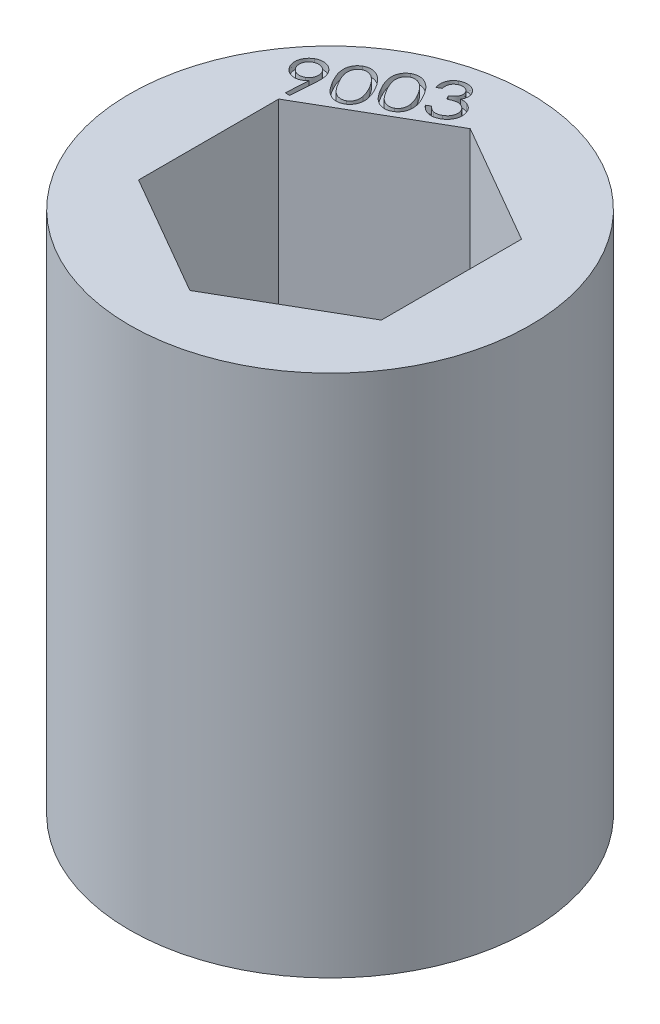
from build123d import *

# Parameters (mm, degrees)
SKETCH1_R           = 11.1125
BOSS_EXTRUDE1_DEPTH = 29.0449
CUT_EXTRUDE1_DEPTH  = 0.4


with BuildPart() as part:
    # Sketch1 → Boss-Extrude1 (new body)
    with BuildSketch(Plane(origin=(0, 0, 0), x_dir=(1, 0, 0), z_dir=(0, 1, 0))):
        with Locations(Location((0, 0, 0), (0, 0, 270))):
            Circle(SKETCH1_R)
        Polygon((6.731, -3.886144662), (6.731, 3.886144662), (0, 7.772289324), (-6.731, 3.886144662), (-6.731, -3.886144662), (0, -7.772289324), align=None, mode=Mode.SUBTRACT)
    extrude(amount=BOSS_EXTRUDE1_DEPTH)

    # Sketch2 → Cut-Extrude1 (cut)
    # profile 1 of 4: a face of its own
    with BuildSketch(Plane(origin=(0, 29.0449, 0), x_dir=(1, 0, 0), z_dir=(0, 1, 0))):
        with BuildLine():
            Line((-6.598355461, 4.357896038), (-6.846147929, 4.370107577))
            Line((-6.846147929, 4.370107577), (-6.772878698, 5.613140429))
            add(Edge.make_bspline(
                [(-6.772878698, 5.613140429), (-6.788864714, 5.595711477), (-6.819961058, 5.561808304), (-6.870461775, 5.517091536), (-6.921032154, 5.477274681), (-6.956844141, 5.455418497), (-6.974369082, 5.444722961)],
                knots=[0, 0, 0, 0, 1.07557127, 2.092224476, 3.066411598, 4, 4, 4, 4], degree=3))
            add(Edge.make_bspline(
                [(-6.974369082, 5.444722961), (-6.996027616, 5.432904379), (-7.038879978, 5.409520792), (-7.106176492, 5.382805548), (-7.1743062, 5.363019261), (-7.243485923, 5.351634769), (-7.313327188, 5.34617577), (-7.384307962, 5.348904522), (-7.456015187, 5.359263899), (-7.52786841, 5.376537909), (-7.598132561, 5.400154482), (-7.665130923, 5.430284828), (-7.728072742, 5.466545614), (-7.786704707, 5.509042728), (-7.84153947, 5.557109349), (-7.89205935, 5.611245018), (-7.938164198, 5.671760524), (-7.965060712, 5.71550577), (-7.978768121, 5.737799884)],
                knots=[0, 0, 0, 0, 1.015135184, 2.008489705, 2.974464217, 3.930823522, 4.890110555, 5.854468119, 6.84900024, 7.868689235, 8.893387844, 9.896732215, 10.888539014, 11.878968029, 12.873598221, 13.886496971, 14.922884625, 16, 16, 16, 16], degree=3))
            add(Edge.make_bspline(
                [(-7.978768121, 5.737799884), (-7.995611595, 5.769279769), (-8.028750743, 5.831215719), (-8.062305572, 5.929820561), (-8.084162813, 6.029511748), (-8.090172936, 6.130611364), (-8.084137157, 6.231502917), (-8.062669024, 6.330535767), (-8.028206879, 6.427199519), (-7.980529557, 6.520164838), (-7.921196046, 6.607161568), (-7.852461509, 6.686255603), (-7.773156137, 6.754991782), (-7.714032388, 6.792128443), (-7.684164756, 6.810888827)],
                knots=[0, 0, 0, 0, 1.035324533, 2.036977218, 3.013660684, 3.991039457, 4.968418229, 5.940283026, 6.923354643, 7.941094773, 8.965736768, 9.974485588, 10.976767849, 12, 12, 12, 12], degree=3))
            add(Edge.make_bspline(
                [(-7.684164756, 6.810888827), (-7.653693123, 6.827192744), (-7.593433111, 6.859435004), (-7.4967602, 6.892254026), (-7.397402332, 6.912378093), (-7.296149159, 6.919369798), (-7.194788036, 6.913586556), (-7.095880553, 6.893418492), (-6.999961911, 6.86016036), (-6.909304283, 6.812588572), (-6.824386747, 6.754924979), (-6.748026257, 6.68747898), (-6.681468398, 6.610520658), (-6.645475527, 6.553253132), (-6.627357865, 6.524426487)],
                knots=[0, 0, 0, 0, 1.019400264, 2.015942902, 3.002372847, 4.006779929, 5.005536382, 5.991966327, 6.979044859, 7.994053264, 9.007032045, 10.004279611, 10.995418019, 12, 12, 12, 12], degree=3))
            add(Edge.make_bspline(
                [(-6.627357865, 6.524426487), (-6.614862873, 6.501068901), (-6.589434869, 6.45353491), (-6.559163833, 6.37672861), (-6.534915546, 6.294426336), (-6.519193441, 6.221904552), (-6.509936287, 6.160237223), (-6.504111937, 6.110024927), (-6.501071936, 6.056340366), (-6.498121146, 5.999194236), (-6.497929673, 5.938775024), (-6.498936684, 5.874822916), (-6.501451823, 5.807470523), (-6.504296769, 5.761369683), (-6.505751294, 5.737799884)],
                knots=[0, 0, 0, 0, 1.179517641, 2.400384276, 3.669978525, 4.99951221, 5.702757638, 6.447991837, 7.250775919, 8.098000084, 8.997311831, 9.942054579, 10.947842213, 12, 12, 12, 12], degree=3))
            Line((-6.505751294, 5.737799884), (-6.598355461, 4.357896038))
        make_face()
        with BuildLine():
            add(Edge.make_bspline(
                [(-7.034917961, 5.66656591), (-7.019269493, 5.676088627), (-6.988537053, 5.694790541), (-6.946707271, 5.727867056), (-6.908591753, 5.763381258), (-6.875542002, 5.802952601), (-6.846336799, 5.845338903), (-6.8213924, 5.890890013), (-6.800208249, 5.939485892), (-6.784487326, 5.990958285), (-6.772439824, 6.043461533), (-6.766678935, 6.096191308), (-6.764740866, 6.148129668), (-6.76886222, 6.199521812), (-6.778826156, 6.249855233), (-6.792974762, 6.299751596), (-6.812959799, 6.348796291), (-6.829909236, 6.380239364), (-6.838515717, 6.396205333)],
                knots=[0, 0, 0, 0, 1.045108442, 2.052516081, 3.039037663, 4.014948609, 4.990090363, 5.974041511, 6.976128051, 8.011453109, 9.043011603, 10.047295345, 11.035574291, 12.007150616, 12.98344593, 13.961229243, 14.964765542, 16, 16, 16, 16], degree=3))
            add(Edge.make_bspline(
                [(-6.838515717, 6.396205333), (-6.847871356, 6.411679568), (-6.86636199, 6.442263091), (-6.89914416, 6.483897706), (-6.935003914, 6.521507302), (-6.974365916, 6.554596992), (-7.016803772, 6.583720642), (-7.062203872, 6.60884321), (-7.111061882, 6.62922912), (-7.162373534, 6.645218392), (-7.214952681, 6.656911905), (-7.267576663, 6.663781619), (-7.319597528, 6.66468438), (-7.370883969, 6.660584098), (-7.421612083, 6.651535287), (-7.471568591, 6.636387785), (-7.521278238, 6.61688834), (-7.552729794, 6.599421478), (-7.568663954, 6.59057232)],
                knots=[0, 0, 0, 0, 1.031712043, 2.039092063, 3.018573684, 3.994457873, 4.969572892, 5.953497063, 6.951758218, 7.98705489, 9.018585102, 10.024008046, 11.012022604, 11.983572292, 12.958061913, 13.947831088, 14.960318852, 16, 16, 16, 16], degree=3))
            add(Edge.make_bspline(
                [(-7.568663954, 6.59057232), (-7.584170502, 6.581255909), (-7.61470341, 6.562911586), (-7.655879463, 6.529593085), (-7.694002078, 6.494296313), (-7.726978587, 6.454666761), (-7.756327049, 6.412455587), (-7.780550555, 6.366603147), (-7.801887935, 6.318183416), (-7.817557037, 6.266682733), (-7.82961885, 6.214187069), (-7.83535615, 6.161624158), (-7.837312362, 6.109857024), (-7.833190206, 6.058633972), (-7.823230135, 6.008300645), (-7.809080486, 5.958404257), (-7.789095732, 5.909359568), (-7.772146256, 5.877916495), (-7.763539756, 5.861950525)],
                knots=[0, 0, 0, 0, 1.034021631, 2.036022986, 3.024725885, 4.002794686, 4.980092595, 5.961574923, 6.965877195, 8.00349148, 9.037330872, 10.043835206, 11.024597356, 11.998321951, 12.97677597, 13.956721278, 14.962476515, 16, 16, 16, 16], degree=3))
            add(Edge.make_bspline(
                [(-7.763539756, 5.861950525), (-7.754184522, 5.846475673), (-7.735694691, 5.81589093), (-7.702906669, 5.774265215), (-7.667068422, 5.736622907), (-7.627734056, 5.703743934), (-7.585718977, 5.674233861), (-7.540217555, 5.649466258), (-7.491641806, 5.628251814), (-7.440163817, 5.612539313), (-7.38766207, 5.60048955), (-7.334931905, 5.594729249), (-7.282993647, 5.592791027), (-7.231601476, 5.596912421), (-7.181268062, 5.606876346), (-7.131371697, 5.621024955), (-7.082327002, 5.641009992), (-7.05088393, 5.657959429), (-7.034917961, 5.66656591)],
                knots=[0, 0, 0, 0, 1.033571637, 2.042767394, 3.024014467, 4.001657624, 4.970548117, 5.956245748, 6.96011096, 7.997273687, 9.030663166, 10.03672948, 11.026762591, 12.000063433, 12.97809164, 13.957610489, 14.962928033, 16, 16, 16, 16], degree=3))
        make_face(mode=Mode.SUBTRACT)
    # profile 2 of 4: a face of its own
    with BuildSketch(Plane(origin=(0, 29.0449, 0), x_dir=(1, 0, 0), z_dir=(0, 1, 0))):
        with BuildLine():
            add(Edge.make_bspline(
                [(-6.062809511, 6.205908859), (-6.082915658, 6.241213231), (-6.122019175, 6.309875075), (-6.174656197, 6.412282578), (-6.221774323, 6.509813869), (-6.262072141, 6.602981302), (-6.295917571, 6.691537875), (-6.322887041, 6.775666651), (-6.344260428, 6.855197202), (-6.358510659, 6.930930861), (-6.367241982, 7.003365304), (-6.371223871, 7.073038031), (-6.371478384, 7.14050867), (-6.366893402, 7.205811525), (-6.357828111, 7.268933517), (-6.344055002, 7.329853086), (-6.325598272, 7.388464523), (-6.303242535, 7.444957262), (-6.277074823, 7.498956073), (-6.245971467, 7.549318144), (-6.21280028, 7.597425621), (-6.175243181, 7.641625167), (-6.134995217, 7.683385044), (-6.090531578, 7.721208048), (-6.043175963, 7.756801283), (-6.009230412, 7.777404912), (-5.992084351, 7.787811904)],
                knots=[0, 0, 0, 0, 1.642217524, 3.193873097, 4.653599743, 6.020219012, 7.296149585, 8.484364078, 9.590266645, 10.622995624, 11.596731579, 12.537641419, 13.442669779, 14.322439731, 15.181528583, 16.018162769, 16.844365298, 17.663022962, 18.472528165, 19.266229043, 20.053716379, 20.832379209, 21.608138827, 22.395685855, 23.18965321, 24, 24, 24, 24], degree=3))
            add(Edge.make_bspline(
                [(-5.992084351, 7.787811904), (-5.974256713, 7.797613629), (-5.938913661, 7.817045418), (-5.883569808, 7.840677277), (-5.827828183, 7.860841538), (-5.770743017, 7.875622824), (-5.712884751, 7.88574646), (-5.653853901, 7.891399375), (-5.593970317, 7.892375784), (-5.533266337, 7.888714413), (-5.471934607, 7.880772777), (-5.410521328, 7.866935525), (-5.349299474, 7.847750081), (-5.287727945, 7.824621227), (-5.22704648, 7.794722829), (-5.166095387, 7.760368326), (-5.104965892, 7.721377255), (-5.044390875, 7.676169596), (-4.983125826, 7.625542358), (-4.922505127, 7.567525488), (-4.861616669, 7.502539905), (-4.801373878, 7.430341593), (-4.741318852, 7.350960318), (-4.680544759, 7.265093467), (-4.620831969, 7.171385014), (-4.582139772, 7.105945627), (-4.562316723, 7.072419275)],
                knots=[0, 0, 0, 0, 0.815881076, 1.617473213, 2.411751612, 3.192532544, 3.980223438, 4.766442947, 5.569622482, 6.380892254, 7.204795063, 8.048528362, 8.903143009, 9.777765604, 10.684831081, 11.614241792, 12.584586996, 13.591843045, 14.645331516, 15.771781295, 16.956234458, 18.217113798, 19.542884518, 20.949560407, 22.437178076, 24, 24, 24, 24], degree=3))
            add(Edge.make_bspline(
                [(-4.562316723, 7.072419275), (-4.543312875, 7.038597047), (-4.506249772, 6.972633735), (-4.455016991, 6.874526574), (-4.411010566, 6.77942361), (-4.372379623, 6.688105499), (-4.34043532, 6.600262208), (-4.314088229, 6.51595685), (-4.294178627, 6.435078985), (-4.280175723, 6.357397142), (-4.272385411, 6.282552936), (-4.267753497, 6.210544887), (-4.2691827, 6.140865887), (-4.273761909, 6.073470233), (-4.284273749, 6.008422226), (-4.298289042, 5.945579715), (-4.317156733, 5.885315328), (-4.340723943, 5.827749719), (-4.36796593, 5.772885384), (-4.39945707, 5.721345977), (-4.433267076, 5.672341106), (-4.471035107, 5.626672817), (-4.513229687, 5.585156545), (-4.557769799, 5.545849061), (-4.605976313, 5.509724128), (-4.640485635, 5.48887189), (-4.657973774, 5.478304692)],
                knots=[0, 0, 0, 0, 1.558572261, 3.039675171, 4.44500239, 5.767404933, 7.021920233, 8.19867626, 9.314183841, 10.366093107, 11.366862767, 12.335955634, 13.262731656, 14.164729598, 15.047477431, 15.907015182, 16.749641984, 17.580952634, 18.403702246, 19.207672054, 20.005351578, 20.794016824, 21.584181799, 22.380929523, 23.179510693, 24, 24, 24, 24], degree=3))
            add(Edge.make_bspline(
                [(-4.657973774, 5.478304692), (-4.675490038, 5.468740296), (-4.710270171, 5.449749318), (-4.764206789, 5.425635226), (-4.819542798, 5.407055827), (-4.875347505, 5.391905469), (-4.93230514, 5.382546733), (-4.989921221, 5.37670867), (-5.048618828, 5.375852517), (-5.108036205, 5.379192271), (-5.167677293, 5.388186067), (-5.227421614, 5.401024475), (-5.28654438, 5.420419966), (-5.345831974, 5.443717316), (-5.404926689, 5.472446443), (-5.463983037, 5.505980951), (-5.522577588, 5.545026051), (-5.581614741, 5.58883912), (-5.640268105, 5.63968601), (-5.69958948, 5.697585031), (-5.759441302, 5.763112365), (-5.819377976, 5.836749383), (-5.880097416, 5.917809298), (-5.940703878, 6.006905526), (-6.002700965, 6.103211029), (-6.042369443, 6.170986193), (-6.062809511, 6.205908859)],
                knots=[0, 0, 0, 0, 0.807491903, 1.603348545, 2.386916451, 3.167713854, 3.940658363, 4.719915701, 5.50935356, 6.313835313, 7.125313705, 7.947948844, 8.783651521, 9.640150085, 10.524255013, 11.440287308, 12.386399569, 13.372019105, 14.413529699, 15.525036669, 16.724996316, 18.002813491, 19.365932914, 20.822335035, 22.362637201, 24, 24, 24, 24], degree=3))
        make_face()
        with BuildLine():
            add(Edge.make_bspline(
                [(-5.852669287, 6.32140966), (-5.835208653, 6.291452258), (-5.801397235, 6.233441638), (-5.749344905, 6.15088375), (-5.698461984, 6.07514583), (-5.649351496, 6.005760887), (-5.601093746, 5.943508849), (-5.55364127, 5.888541706), (-5.507939043, 5.839824001), (-5.462846979, 5.797720872), (-5.418018196, 5.761175024), (-5.373209535, 5.728960986), (-5.3279313, 5.70101178), (-5.282589064, 5.676928917), (-5.23681649, 5.656938325), (-5.19085526, 5.64045682), (-5.144233865, 5.628976309), (-5.083175813, 5.618040821), (-5.008197851, 5.613853809), (-4.921559855, 5.622509197), (-4.839570384, 5.643895531), (-4.790056323, 5.669197069), (-4.76533355, 5.681830333)],
                knots=[0, 0, 0, 0, 1.475228016, 2.856686104, 4.15161897, 5.357081144, 6.47289893, 7.501387829, 8.445726694, 9.313720896, 10.124066195, 10.905058304, 11.660046733, 12.386348828, 13.08755313, 13.783651734, 14.460982071, 15.127735434, 16.421461315, 17.639985157, 18.821625413, 20, 20, 20, 20], degree=3))
            add(Edge.make_bspline(
                [(-4.76533355, 5.681830333), (-4.741832268, 5.696984554), (-4.695095654, 5.727121505), (-4.635260688, 5.786851944), (-4.585254589, 5.856751843), (-4.551822138, 5.922530467), (-4.531196504, 5.979639176), (-4.518164402, 6.024928674), (-4.509810591, 6.072515738), (-4.504496544, 6.121823726), (-4.503942481, 6.173023731), (-4.505677671, 6.226066029), (-4.5119235, 6.2809619), (-4.518681231, 6.317883674), (-4.522120409, 6.336674083)],
                knots=[0, 0, 0, 0, 1.342886321, 2.670576022, 4.038999414, 5.466462105, 6.205051725, 6.959707281, 7.731476591, 8.527516338, 9.344012544, 10.193626534, 11.080691652, 12, 12, 12, 12], degree=3))
            add(Edge.make_bspline(
                [(-4.522120409, 6.336674083), (-4.526923687, 6.360485524), (-4.536699476, 6.408947354), (-4.557023801, 6.48165033), (-4.580913205, 6.556239717), (-4.609297259, 6.632127806), (-4.642293402, 6.709349431), (-4.678795675, 6.788244225), (-4.720014948, 6.868719848), (-4.750373811, 6.922091932), (-4.765842364, 6.949286262)],
                knots=[0, 0, 0, 0, 0.879876913, 1.790754508, 2.73331625, 3.717259664, 4.725112015, 5.77538776, 6.866507818, 8, 8, 8, 8], degree=3))
            add(Edge.make_bspline(
                [(-4.765842364, 6.949286262), (-4.781575844, 6.976212113), (-4.812359769, 7.02889489), (-4.86095363, 7.103874502), (-4.908595154, 7.174498877), (-4.956915948, 7.23974614), (-5.005817917, 7.299541747), (-5.054067683, 7.354972678), (-5.10294632, 7.404787783), (-5.151903766, 7.449753667), (-5.200746818, 7.48987811), (-5.248914016, 7.525749658), (-5.297203452, 7.556382889), (-5.344938521, 7.583112372), (-5.392665232, 7.60484073), (-5.439849373, 7.622508021), (-5.486852819, 7.635354401), (-5.548109252, 7.645797129), (-5.622641395, 7.65009549), (-5.708706197, 7.642246841), (-5.789903048, 7.620660396), (-5.838957607, 7.595688265), (-5.863354383, 7.583268634)],
                knots=[0, 0, 0, 0, 1.327522451, 2.597413504, 3.803087542, 4.954092809, 6.052504639, 7.091116491, 8.08170511, 9.022070092, 9.919800897, 10.771882377, 11.577119672, 12.352806521, 13.099205072, 13.807429758, 14.495830891, 15.170113202, 16.450227669, 17.661618134, 18.837030004, 20, 20, 20, 20], degree=3))
            add(Edge.make_bspline(
                [(-5.863354383, 7.583268634), (-5.886890302, 7.568145944), (-5.933796306, 7.538007117), (-5.993340773, 7.477518649), (-6.044374308, 7.407224434), (-6.077385517, 7.340179617), (-6.099346568, 7.282609341), (-6.111133271, 7.236593582), (-6.120517391, 7.189072402), (-6.126227153, 7.139557728), (-6.127278826, 7.088193991), (-6.126177517, 7.035133924), (-6.11999488, 6.980501786), (-6.111648193, 6.923473373), (-6.098120247, 6.863264749), (-6.079098581, 6.79908088), (-6.054375083, 6.730470297), (-6.024874815, 6.657059747), (-5.989628856, 6.579451556), (-5.949143771, 6.497212578), (-5.90360949, 6.410354322), (-5.869994702, 6.351660878), (-5.852669287, 6.32140966)],
                knots=[0, 0, 0, 0, 1.186584607, 2.364808541, 3.584028067, 4.867913378, 5.52979883, 6.201670858, 6.884946004, 7.589109066, 8.317961587, 9.068444384, 9.84432244, 10.65432116, 11.518850237, 12.466086659, 13.499587148, 14.619373863, 15.830028341, 17.123623296, 18.517485242, 20, 20, 20, 20], degree=3))
        make_face(mode=Mode.SUBTRACT)
    # profile 3 of 4: a face of its own
    with BuildSketch(Plane(origin=(0, 29.0449, 0), x_dir=(1, 0, 0), z_dir=(0, 1, 0))):
        with BuildLine():
            add(Edge.make_bspline(
                [(-4.370729107, 7.182831936), (-4.390835254, 7.218136308), (-4.429938771, 7.286798152), (-4.482575792, 7.389205655), (-4.529693919, 7.486736946), (-4.569991737, 7.579904379), (-4.603837167, 7.668460952), (-4.630806637, 7.752589727), (-4.652180024, 7.832120278), (-4.666430254, 7.907853938), (-4.675161578, 7.980288381), (-4.679143467, 8.049961108), (-4.67939798, 8.117431747), (-4.674812998, 8.182734602), (-4.665747707, 8.245856594), (-4.651974598, 8.306776163), (-4.633517868, 8.3653876), (-4.611162131, 8.421880339), (-4.584994419, 8.47587915), (-4.553891063, 8.526241221), (-4.520719875, 8.574348698), (-4.483162777, 8.618548244), (-4.442914813, 8.660308121), (-4.398451173, 8.698131125), (-4.351095559, 8.73372436), (-4.317150008, 8.754327988), (-4.300003947, 8.76473498)],
                knots=[0, 0, 0, 0, 1.642217524, 3.193873097, 4.653599743, 6.020219012, 7.296149585, 8.484364078, 9.590266645, 10.622995624, 11.596731579, 12.537641419, 13.442669779, 14.322439731, 15.181528583, 16.018162769, 16.844365298, 17.663022962, 18.472528165, 19.266229043, 20.053716379, 20.832379209, 21.608138827, 22.395685855, 23.18965321, 24, 24, 24, 24], degree=3))
            add(Edge.make_bspline(
                [(-4.300003947, 8.76473498), (-4.282176309, 8.774536706), (-4.246833256, 8.793968495), (-4.191489404, 8.817600354), (-4.135747778, 8.837764615), (-4.078662613, 8.852545901), (-4.020804346, 8.862669537), (-3.961773496, 8.868322452), (-3.901889913, 8.869298861), (-3.841185933, 8.86563749), (-3.779854202, 8.857695854), (-3.718440924, 8.843858602), (-3.65721907, 8.824673158), (-3.59564754, 8.801544304), (-3.534966076, 8.771645906), (-3.474014982, 8.737291403), (-3.412885487, 8.698300332), (-3.352310471, 8.653092673), (-3.291045421, 8.602465435), (-3.230424723, 8.544448564), (-3.169536265, 8.479462982), (-3.109293474, 8.40726467), (-3.049238447, 8.327883395), (-2.988464355, 8.242016544), (-2.928751564, 8.148308091), (-2.890059368, 8.082868704), (-2.870236319, 8.049342352)],
                knots=[0, 0, 0, 0, 0.815881076, 1.617473213, 2.411751612, 3.192532544, 3.980223438, 4.766442947, 5.569622482, 6.380892254, 7.204795063, 8.048528362, 8.903143009, 9.777765604, 10.684831081, 11.614241792, 12.584586996, 13.591843045, 14.645331516, 15.771781295, 16.956234458, 18.217113798, 19.542884518, 20.949560407, 22.437178076, 24, 24, 24, 24], degree=3))
            add(Edge.make_bspline(
                [(-2.870236319, 8.049342352), (-2.851232471, 8.015520124), (-2.814169368, 7.949556812), (-2.762936586, 7.851449651), (-2.718930161, 7.756346687), (-2.680299219, 7.665028576), (-2.648354915, 7.577185285), (-2.622007825, 7.492879927), (-2.602098223, 7.412002062), (-2.588095319, 7.334320219), (-2.580305007, 7.259476013), (-2.575673093, 7.187467964), (-2.577102296, 7.117788964), (-2.581681505, 7.05039331), (-2.592193345, 6.985345303), (-2.606208637, 6.922502792), (-2.625076329, 6.862238405), (-2.648643538, 6.804672796), (-2.675885526, 6.749808461), (-2.707376666, 6.698269054), (-2.741186672, 6.649264183), (-2.778954702, 6.603595894), (-2.821149282, 6.562079621), (-2.865689395, 6.522772138), (-2.913895909, 6.486647205), (-2.948405231, 6.465794967), (-2.96589337, 6.455227769)],
                knots=[0, 0, 0, 0, 1.558572261, 3.039675171, 4.44500239, 5.767404933, 7.021920233, 8.19867626, 9.314183841, 10.366093107, 11.366862767, 12.335955634, 13.262731656, 14.164729598, 15.047477431, 15.907015182, 16.749641984, 17.580952634, 18.403702246, 19.207672054, 20.005351578, 20.794016824, 21.584181799, 22.380929523, 23.179510693, 24, 24, 24, 24], degree=3))
            add(Edge.make_bspline(
                [(-2.96589337, 6.455227769), (-2.983409634, 6.445663373), (-3.018189767, 6.426672395), (-3.072126385, 6.402558303), (-3.127462394, 6.383978904), (-3.183267101, 6.368828546), (-3.240224736, 6.35946981), (-3.297840817, 6.353631747), (-3.356538424, 6.352775594), (-3.415955801, 6.356115348), (-3.475596889, 6.365109144), (-3.53534121, 6.377947552), (-3.594463976, 6.397343043), (-3.65375157, 6.420640393), (-3.712846285, 6.44936952), (-3.771902633, 6.482904028), (-3.830497184, 6.521949128), (-3.889534337, 6.565762197), (-3.9481877, 6.616609087), (-4.007509076, 6.674508108), (-4.067360898, 6.740035441), (-4.127297572, 6.81367246), (-4.188017012, 6.894732375), (-4.248623474, 6.983828603), (-4.310620561, 7.080134106), (-4.350289039, 7.14790927), (-4.370729107, 7.182831936)],
                knots=[0, 0, 0, 0, 0.807491903, 1.603348545, 2.386916451, 3.167713854, 3.940658363, 4.719915701, 5.50935356, 6.313835313, 7.125313705, 7.947948844, 8.783651521, 9.640150085, 10.524255013, 11.440287308, 12.386399569, 13.372019105, 14.413529699, 15.525036669, 16.724996316, 18.002813491, 19.365932914, 20.822335035, 22.362637201, 24, 24, 24, 24], degree=3))
        make_face()
        with BuildLine():
            add(Edge.make_bspline(
                [(-4.160588883, 7.298332737), (-4.143128249, 7.268375335), (-4.109316831, 7.210364715), (-4.0572645, 7.127806827), (-4.00638158, 7.052068907), (-3.957271092, 6.982683964), (-3.909013342, 6.920431926), (-3.861560866, 6.865464783), (-3.815858638, 6.816747078), (-3.770766574, 6.774643949), (-3.725937791, 6.738098101), (-3.681129131, 6.705884063), (-3.635850896, 6.677934857), (-3.59050866, 6.653851994), (-3.544736086, 6.633861402), (-3.498774856, 6.617379897), (-3.45215346, 6.605899385), (-3.391095409, 6.594963898), (-3.316117447, 6.590776885), (-3.229479451, 6.599432274), (-3.14748998, 6.620818608), (-3.097975919, 6.646120146), (-3.073253146, 6.65875341)],
                knots=[0, 0, 0, 0, 1.475228016, 2.856686104, 4.15161897, 5.357081144, 6.47289893, 7.501387829, 8.445726694, 9.313720896, 10.124066195, 10.905058304, 11.660046733, 12.386348828, 13.08755313, 13.783651734, 14.460982071, 15.127735434, 16.421461315, 17.639985157, 18.821625413, 20, 20, 20, 20], degree=3))
            add(Edge.make_bspline(
                [(-3.073253146, 6.65875341), (-3.049751864, 6.673907631), (-3.00301525, 6.704044582), (-2.943180284, 6.763775021), (-2.893174185, 6.83367492), (-2.859741734, 6.899453544), (-2.839116099, 6.956562253), (-2.826083998, 7.001851751), (-2.817730187, 7.049438815), (-2.81241614, 7.098746803), (-2.811862077, 7.149946808), (-2.813597267, 7.202989106), (-2.819843096, 7.257884977), (-2.826600827, 7.294806751), (-2.830040005, 7.31359716)],
                knots=[0, 0, 0, 0, 1.342886321, 2.670576022, 4.038999414, 5.466462105, 6.205051725, 6.959707281, 7.731476591, 8.527516338, 9.344012544, 10.193626534, 11.080691652, 12, 12, 12, 12], degree=3))
            add(Edge.make_bspline(
                [(-2.830040005, 7.31359716), (-2.834843282, 7.337408601), (-2.844619072, 7.385870431), (-2.864943397, 7.458573407), (-2.888832801, 7.533162794), (-2.917216855, 7.609050883), (-2.950212997, 7.686272508), (-2.986715271, 7.765167302), (-3.027934543, 7.845642925), (-3.058293406, 7.899015009), (-3.07376196, 7.926209339)],
                knots=[0, 0, 0, 0, 0.879876913, 1.790754508, 2.73331625, 3.717259664, 4.725112015, 5.77538776, 6.866507818, 8, 8, 8, 8], degree=3))
            add(Edge.make_bspline(
                [(-3.07376196, 7.926209339), (-3.089495439, 7.95313519), (-3.120279365, 8.005817967), (-3.168873225, 8.080797579), (-3.216514749, 8.151421954), (-3.264835544, 8.216669217), (-3.313737513, 8.276464824), (-3.361987279, 8.331895755), (-3.410865915, 8.38171086), (-3.459823361, 8.426676744), (-3.508666413, 8.466801186), (-3.556833612, 8.502672735), (-3.605123048, 8.533305965), (-3.652858116, 8.560035449), (-3.700584828, 8.581763807), (-3.747768968, 8.599431098), (-3.794772415, 8.612277478), (-3.856028848, 8.622720206), (-3.930560991, 8.627018567), (-4.016625793, 8.619169918), (-4.097822643, 8.597583473), (-4.146877202, 8.572611342), (-4.171273979, 8.560191711)],
                knots=[0, 0, 0, 0, 1.327522451, 2.597413504, 3.803087542, 4.954092809, 6.052504639, 7.091116491, 8.08170511, 9.022070092, 9.919800897, 10.771882377, 11.577119672, 12.352806521, 13.099205072, 13.807429758, 14.495830891, 15.170113202, 16.450227669, 17.661618134, 18.837030004, 20, 20, 20, 20], degree=3))
            add(Edge.make_bspline(
                [(-4.171273979, 8.560191711), (-4.194809898, 8.545069021), (-4.241715902, 8.514930194), (-4.301260368, 8.454441726), (-4.352293904, 8.384147511), (-4.385305113, 8.317102694), (-4.407266163, 8.259532418), (-4.419052867, 8.213516658), (-4.428436987, 8.165995479), (-4.434146748, 8.116480805), (-4.435198422, 8.065117068), (-4.434097113, 8.012057001), (-4.427914476, 7.957424863), (-4.419567789, 7.90039645), (-4.406039843, 7.840187826), (-4.387018176, 7.776003957), (-4.362294679, 7.707393374), (-4.332794411, 7.633982824), (-4.297548451, 7.556374633), (-4.257063367, 7.474135655), (-4.211529086, 7.387277399), (-4.177914298, 7.328583955), (-4.160588883, 7.298332737)],
                knots=[0, 0, 0, 0, 1.186584607, 2.364808541, 3.584028067, 4.867913378, 5.52979883, 6.201670858, 6.884946004, 7.589109066, 8.317961587, 9.068444384, 9.84432244, 10.65432116, 11.518850237, 12.466086659, 13.499587148, 14.619373863, 15.830028341, 17.123623296, 18.517485242, 20, 20, 20, 20], degree=3))
        make_face(mode=Mode.SUBTRACT)
    # profile 4 of 4: a face of its own
    with BuildSketch(Plane(origin=(0, 29.0449, 0), x_dir=(1, 0, 0), z_dir=(0, 1, 0))):
        with BuildLine():
            Line((-2.71172162, 8.928064307), (-2.936108639, 8.798316711))
            add(Edge.make_bspline(
                [(-2.936108639, 8.798316711), (-2.943422575, 8.823496953), (-2.957790728, 8.872963278), (-2.972802018, 8.947321458), (-2.982947953, 9.019709369), (-2.986097377, 9.09016208), (-2.985329982, 9.158647025), (-2.976504048, 9.225100802), (-2.963787741, 9.289977387), (-2.94412242, 9.352500694), (-2.919867407, 9.412449187), (-2.890762238, 9.46916298), (-2.85699476, 9.522572231), (-2.818196265, 9.572213544), (-2.775340462, 9.61909212), (-2.727247792, 9.661537186), (-2.675057508, 9.70135353), (-2.637317975, 9.724350385), (-2.618099825, 9.736061102)],
                knots=[0, 0, 0, 0, 1.167375888, 2.293297889, 3.375521375, 4.419309756, 5.431795653, 6.421221817, 7.400474185, 8.372943568, 9.335237775, 10.277820939, 11.20827897, 12.145093331, 13.080597184, 14.032877155, 14.998279508, 16, 16, 16, 16], degree=3))
            add(Edge.make_bspline(
                [(-2.618099825, 9.736061102), (-2.589456967, 9.751435047), (-2.532699538, 9.781899381), (-2.441549072, 9.813555705), (-2.348037392, 9.834865315), (-2.252631241, 9.843603523), (-2.15830524, 9.842049538), (-2.067077346, 9.828227505), (-1.980371644, 9.80271228), (-1.899208825, 9.765530846), (-1.825140624, 9.71885715), (-1.759484636, 9.664510835), (-1.702137392, 9.603314075), (-1.672691428, 9.556468426), (-1.657967613, 9.533044275)],
                knots=[0, 0, 0, 0, 1.074200881, 2.128589237, 3.18106411, 4.240964204, 5.290667332, 6.295500042, 7.284584252, 8.271564568, 9.240038417, 10.172728565, 11.086312573, 12, 12, 12, 12], degree=3))
            add(Edge.make_bspline(
                [(-1.657967613, 9.533044275), (-1.645367639, 9.509455987), (-1.62061836, 9.4631231), (-1.596451393, 9.388957401), (-1.582361295, 9.31369623), (-1.579102179, 9.236861624), (-1.588275032, 9.158800741), (-1.608204361, 9.079677421), (-1.63801736, 8.998809085), (-1.665956959, 8.946751032), (-1.680355434, 8.919923282)],
                knots=[0, 0, 0, 0, 0.993684363, 1.951827249, 2.889052743, 3.836657995, 4.80211292, 5.803367142, 6.867980745, 8, 8, 8, 8], degree=3))
            add(Edge.make_bspline(
                [(-1.680355434, 8.919923282), (-1.648334093, 8.923266879), (-1.585213776, 8.929857763), (-1.490851874, 8.925803353), (-1.398927969, 8.911259857), (-1.340589411, 8.891584633), (-1.311465209, 8.881762224)],
                knots=[0, 0, 0, 0, 1.030179289, 2.030684612, 3.016863995, 4, 4, 4, 4], degree=3))
            add(Edge.make_bspline(
                [(-1.311465209, 8.881762224), (-1.291667297, 8.873737854), (-1.25260299, 8.857904544), (-1.196672101, 8.829392753), (-1.145086294, 8.795968274), (-1.096062797, 8.760089856), (-1.051917685, 8.719123745), (-1.011492446, 8.674341588), (-0.973924669, 8.626240276), (-0.952743728, 8.5911236), (-0.942066171, 8.573420878)],
                knots=[0, 0, 0, 0, 1.043578998, 2.059140917, 3.061497247, 4.0443764, 5.023860692, 5.997754617, 6.990644963, 8, 8, 8, 8], degree=3))
            add(Edge.make_bspline(
                [(-0.942066171, 8.573420878), (-0.925343389, 8.541785055), (-0.892051172, 8.478803505), (-0.858884722, 8.376344629), (-0.838104765, 8.269565144), (-0.833552314, 8.177590466), (-0.836092295, 8.103491945), (-0.841758015, 8.048428524), (-0.85070793, 7.994276743), (-0.864234705, 7.941555363), (-0.880381118, 7.889543433), (-0.900908036, 7.839068119), (-0.924237502, 7.789205217), (-0.961026705, 7.725085332), (-1.014508596, 7.648664148), (-1.091371742, 7.565676669), (-1.179517919, 7.490486963), (-1.246079794, 7.449451095), (-1.279918735, 7.428589147)],
                knots=[0, 0, 0, 0, 1.28952471, 2.567224695, 3.869920332, 5.206510985, 5.880363085, 6.54494688, 7.203155964, 7.859426282, 8.508028052, 9.167374921, 9.824586825, 10.493554763, 11.833631796, 13.181071791, 14.566904166, 16, 16, 16, 16], degree=3))
            add(Edge.make_bspline(
                [(-1.279918735, 7.428589147), (-1.303462578, 7.415639547), (-1.349515877, 7.39030928), (-1.420929879, 7.35966342), (-1.492082479, 7.335773044), (-1.563313868, 7.318001122), (-1.634765051, 7.307984342), (-1.706118563, 7.304357442), (-1.777526406, 7.307355151), (-1.848608219, 7.317535493), (-1.919178797, 7.334914728), (-1.988394606, 7.359579455), (-2.056624624, 7.390569619), (-2.12289117, 7.429812191), (-2.188146324, 7.475635178), (-2.251801441, 7.528881245), (-2.31415952, 7.58913762), (-2.353301958, 7.633365015), (-2.373360241, 7.656029051)],
                knots=[0, 0, 0, 0, 1.049948212, 2.053767481, 3.032934156, 3.981728119, 4.919406159, 5.848819654, 6.771301382, 7.708979423, 8.651334191, 9.607581917, 10.577750219, 11.57619022, 12.613670697, 13.691816969, 14.817186887, 16, 16, 16, 16], degree=3))
            Line((-2.373360241, 7.656029051), (-2.158131876, 7.780688506))
            add(Edge.make_bspline(
                [(-2.158131876, 7.780688506), (-2.143293818, 7.766353747), (-2.114457565, 7.738495603), (-2.070958852, 7.699317465), (-2.026854557, 7.666131245), (-1.984334312, 7.635944681), (-1.941505838, 7.611712442), (-1.899478225, 7.591771654), (-1.858382631, 7.575333197), (-1.83038458, 7.568698703), (-1.816717613, 7.565460141)],
                knots=[0, 0, 0, 0, 1.210652835, 2.352780436, 3.431589675, 4.447423396, 5.410202577, 6.313818959, 7.176907658, 8, 8, 8, 8], degree=3))
            add(Edge.make_bspline(
                [(-1.816717613, 7.565460141), (-1.799633336, 7.562386004), (-1.765478674, 7.55624023), (-1.713616299, 7.553514763), (-1.661433579, 7.555328055), (-1.609392555, 7.563325883), (-1.556794941, 7.575355364), (-1.504622614, 7.593645652), (-1.451694031, 7.615688461), (-1.417804852, 7.634648861), (-1.400507677, 7.644326327)],
                knots=[0, 0, 0, 0, 0.960250092, 1.919719324, 2.868886039, 3.84629253, 4.830262792, 5.851782114, 6.90354087, 8, 8, 8, 8], degree=3))
            add(Edge.make_bspline(
                [(-1.400507677, 7.644326327), (-1.381291378, 7.656040545), (-1.343758424, 7.678920562), (-1.292283185, 7.718077237), (-1.245490859, 7.758947466), (-1.205145724, 7.803825848), (-1.169749544, 7.850917278), (-1.140774161, 7.901374742), (-1.116459402, 7.954022926), (-1.09841101, 8.009251353), (-1.086041856, 8.065211006), (-1.077937417, 8.120663334), (-1.076170096, 8.175036425), (-1.078770861, 8.228477845), (-1.088377844, 8.280570383), (-1.102525548, 8.331783842), (-1.122454416, 8.38188945), (-1.139513876, 8.413804927), (-1.148135882, 8.429935301)],
                knots=[0, 0, 0, 0, 1.172050046, 2.289228593, 3.365994221, 4.4046504, 5.428153963, 6.430175887, 7.430832577, 8.445405442, 9.451045979, 10.414758793, 11.361131048, 12.281855893, 13.19730531, 14.115140933, 15.047375022, 16, 16, 16, 16], degree=3))
            add(Edge.make_bspline(
                [(-1.148135882, 8.429935301), (-1.161282408, 8.450556242), (-1.187421983, 8.491557391), (-1.237292344, 8.545417033), (-1.294644536, 8.592077338), (-1.359265719, 8.630375239), (-1.428388422, 8.660447623), (-1.501065689, 8.680134187), (-1.575980868, 8.688566218), (-1.640048963, 8.687336512), (-1.693534767, 8.680641078), (-1.737388633, 8.671286661), (-1.78442034, 8.657747293), (-1.835156874, 8.64156765), (-1.889085259, 8.62101492), (-1.946358029, 8.596544073), (-2.007059831, 8.568455433), (-2.048279834, 8.547917169), (-2.069598222, 8.537295077)],
                knots=[0, 0, 0, 0, 1.125477117, 2.237815228, 3.366086006, 4.523243477, 5.689477863, 6.831212969, 7.980419195, 9.153421689, 9.776008207, 10.462965099, 11.217962149, 12.031419499, 12.917219526, 13.877107796, 14.902070915, 16, 16, 16, 16], degree=3))
            Line((-2.069598222, 8.537295077), (-2.186116652, 8.739294275))
            add(Edge.make_bspline(
                [(-2.186116652, 8.739294275), (-2.16194686, 8.754339605), (-2.114471085, 8.783892557), (-2.048846242, 8.834089396), (-1.991752549, 8.890273105), (-1.941589463, 8.949191991), (-1.899903466, 9.009831598), (-1.868990161, 9.071004522), (-1.847869882, 9.130829734), (-1.838258052, 9.189713225), (-1.837486129, 9.246573844), (-1.846099719, 9.301153127), (-1.861394945, 9.353828198), (-1.878389773, 9.386069612), (-1.886933959, 9.402279051)],
                knots=[0, 0, 0, 0, 1.266180123, 2.487108066, 3.66629058, 4.822683044, 5.925529858, 6.931065459, 7.864004537, 8.736007996, 9.57354566, 10.382383672, 11.186739966, 12, 12, 12, 12], degree=3))
            add(Edge.make_bspline(
                [(-1.886933959, 9.402279051), (-1.894176164, 9.413794444), (-1.90848774, 9.436550421), (-1.933677016, 9.467827658), (-1.961642553, 9.495807768), (-1.992407342, 9.520580383), (-2.026383389, 9.541459975), (-2.06321746, 9.559295394), (-2.102882119, 9.574076347), (-2.145019685, 9.585039245), (-2.188370386, 9.592819212), (-2.232392045, 9.595964853), (-2.276292418, 9.594019267), (-2.320386791, 9.589441872), (-2.36406273, 9.578840486), (-2.407837333, 9.564491828), (-2.451555892, 9.545655808), (-2.479986318, 9.530217566), (-2.494457998, 9.522359179)],
                knots=[0, 0, 0, 0, 0.946865682, 1.871134866, 2.789952873, 3.69761661, 4.615446926, 5.561132897, 6.544151416, 7.558468937, 8.589704286, 9.608072091, 10.624588379, 11.647331576, 12.690339784, 13.747500356, 14.853430691, 16, 16, 16, 16], degree=3))
            add(Edge.make_bspline(
                [(-2.494457998, 9.522359179), (-2.516824791, 9.508105248), (-2.5605736, 9.480224966), (-2.616934892, 9.427653581), (-2.661458929, 9.367099006), (-2.690487184, 9.311615773), (-2.707459001, 9.263410802), (-2.717028329, 9.22403296), (-2.723625505, 9.181648217), (-2.726849523, 9.136401366), (-2.72821434, 9.088310532), (-2.725105831, 9.037382335), (-2.720360433, 8.983512044), (-2.714650644, 8.946864083), (-2.71172162, 8.928064307)],
                knots=[0, 0, 0, 0, 1.400382439, 2.739108122, 4.046622513, 5.35815942, 6.033190176, 6.744421047, 7.497821892, 8.298419774, 9.141582518, 10.039481475, 10.994287596, 12, 12, 12, 12], degree=3))
        make_face()
    extrude(amount=-CUT_EXTRUDE1_DEPTH, mode=Mode.SUBTRACT)


solid = part.part
